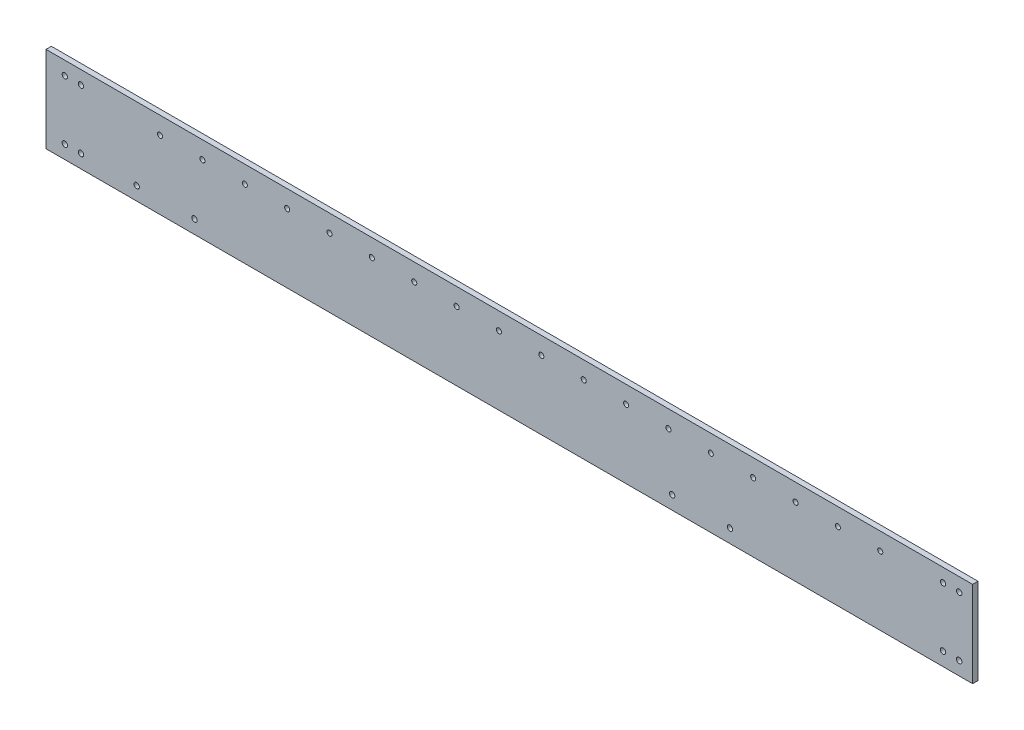
from build123d import *

# Parameters (mm, degrees)
SKETCH1_W                        = 3.175
SKETCH1_H                        = 50.8
BOSS_EXTRUDE1_DEPTH              = 546.825
LEFTSIDEHOLES_SKETCH4_R          = 1.5875
LEFTSIDEHOLES_SKETCH4_R_2        = 1.5
LEFTSIDEHOLES_CUT_EXTRUDE3_DEPTH = 550.1887665


with BuildPart() as part:
    # Sketch1 → Boss-Extrude1 (new body)
    with BuildSketch(Plane(origin=(0, 0, 0), x_dir=(0, 0, -1), z_dir=(1, 0, 0))):
        with Locations((-1.5875, 25.4)):
            Rectangle(SKETCH1_W, SKETCH1_H)
    extrude(amount=BOSS_EXTRUDE1_DEPTH)

    # LeftSideHoles-Sketch4 → LeftSideHoles-Cut-Extrude3 (cut, through all)
    with BuildSketch(Plane.XY.offset(3.175)):
        with Locations((11.1125, 42.8625)):
            Circle(LEFTSIDEHOLES_SKETCH4_R)
        with Locations((529.3625, 42.8625)):
            Circle(LEFTSIDEHOLES_SKETCH4_R)
        with Locations((20.6375, 42.8625)):
            Circle(LEFTSIDEHOLES_SKETCH4_R)
        with Locations((538.8875, 42.8625)):
            Circle(LEFTSIDEHOLES_SKETCH4_R)
        with Locations((11.1125, 7.9375)):
            Circle(LEFTSIDEHOLES_SKETCH4_R)
        with Locations((20.6375, 7.9375)):
            Circle(LEFTSIDEHOLES_SKETCH4_R)
        with Locations((529.3625, 7.9375)):
            Circle(LEFTSIDEHOLES_SKETCH4_R)
        with Locations((538.8875, 7.9375)):
            Circle(LEFTSIDEHOLES_SKETCH4_R)
        with Locations((492.325, 40.575)):
            Circle(LEFTSIDEHOLES_SKETCH4_R_2)
        with Locations((467.325, 40.575)):
            Circle(LEFTSIDEHOLES_SKETCH4_R_2)
        with Locations((442.325, 40.575)):
            Circle(LEFTSIDEHOLES_SKETCH4_R_2)
        with Locations((417.325, 40.575)):
            Circle(LEFTSIDEHOLES_SKETCH4_R_2)
        with Locations((392.325, 40.575)):
            Circle(LEFTSIDEHOLES_SKETCH4_R_2)
        with Locations((367.325, 40.575)):
            Circle(LEFTSIDEHOLES_SKETCH4_R_2)
        with Locations((342.325, 40.575)):
            Circle(LEFTSIDEHOLES_SKETCH4_R_2)
        with Locations((317.325, 40.575)):
            Circle(LEFTSIDEHOLES_SKETCH4_R_2)
        with Locations((292.325, 40.575)):
            Circle(LEFTSIDEHOLES_SKETCH4_R_2)
        with Locations((267.325, 40.575)):
            Circle(LEFTSIDEHOLES_SKETCH4_R_2)
        with Locations((242.325, 40.575)):
            Circle(LEFTSIDEHOLES_SKETCH4_R_2)
        with Locations((217.325, 40.575)):
            Circle(LEFTSIDEHOLES_SKETCH4_R_2)
        with Locations((192.325, 40.575)):
            Circle(LEFTSIDEHOLES_SKETCH4_R_2)
        with Locations((167.325, 40.575)):
            Circle(LEFTSIDEHOLES_SKETCH4_R_2)
        with Locations((142.325, 40.575)):
            Circle(LEFTSIDEHOLES_SKETCH4_R_2)
        with Locations((117.325, 40.575)):
            Circle(LEFTSIDEHOLES_SKETCH4_R_2)
        with Locations((92.325, 40.575)):
            Circle(LEFTSIDEHOLES_SKETCH4_R_2)
        with Locations((67.325, 40.575)):
            Circle(LEFTSIDEHOLES_SKETCH4_R_2)
        with Locations((53.5125, 7.9375)):
            Circle(LEFTSIDEHOLES_SKETCH4_R)
        with Locations((369.5125, 7.9375)):
            Circle(LEFTSIDEHOLES_SKETCH4_R)
        with Locations((87.6375, 7.9375)):
            Circle(LEFTSIDEHOLES_SKETCH4_R)
        with Locations((403.6375, 7.9375)):
            Circle(LEFTSIDEHOLES_SKETCH4_R)
    extrude(amount=-LEFTSIDEHOLES_CUT_EXTRUDE3_DEPTH, mode=Mode.SUBTRACT)


solid = part.part
